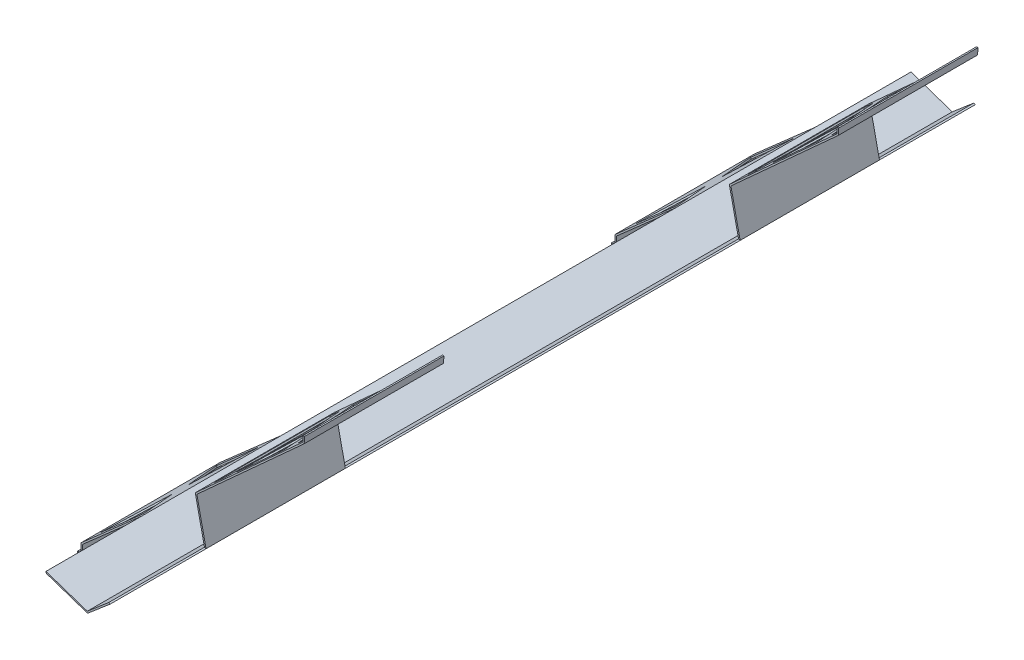
from build123d import *

# Parameters (mm, degrees)
BOSS_EXTRUDE1_DEPTH      = 480
BOSS_EXTRUDE2_DEPTH      = 1360
BOSS_EXTRUDE2_DEPTH_BACK = 810
BOSS_EXTRUDE3_DEPTH      = 480
BOSS_EXTRUDE4_DEPTH      = 330
CUT_EXTRUDE1_DEPTH       = 10
CUT_EXTRUDE1_DEPTH_BACK  = 30


with BuildPart() as part:
    # Sketch1 → Boss-Extrude1 (new body)
    with BuildSketch(Plane.XY):
        Polygon((11, 5), (11, 55), (221.095281021, 240.094497197), (363.24394737, 192.201317564), (437.033049967, 255.054075403), (405.278378965, 401.65435122), (775.552470826, 737.655983503), (777.007438234, 758.382483739), (782.007355561, 758.353577455), (780.57932456, 735.465798021), (410.776173754, 399.891516629), (442.553191716, 253.188072666), (364.330697573, 186.558999959), (222.23449406, 234.434503647), (16, 52.741369955), (16, 0), (0, 0), (0, 25), (5, 25), (5, 5), align=None)
    extrude(amount=BOSS_EXTRUDE1_DEPTH)

    # Sketch3 → Boss-Extrude2 (add, two sides: drawn at the far end of the back side and taken through both)
    with BuildSketch(Plane.XY.offset(480).offset(-BOSS_EXTRUDE2_DEPTH_BACK)):
        Polygon((221.095281021, 240.094497197), (363.24394737, 192.201317564), (437.033049967, 255.054075403), (442.553191716, 253.188072666), (364.330697573, 186.558999959), (222.23449406, 234.434503647), align=None)
    extrude(amount=BOSS_EXTRUDE2_DEPTH + BOSS_EXTRUDE2_DEPTH_BACK)

    # Sketch4 → Boss-Extrude3 (add)
    with BuildSketch(Plane.XY.offset(1840)):
        Polygon((0, 25), (5, 25), (5, 5), (11, 5), (11, 55), (221.095281021, 240.094497197), (363.24394737, 192.201317564), (437.033049967, 255.054075403), (405.278378965, 401.65435122), (775.552470826, 737.655983503), (777.007438234, 758.382483739), (782.007355561, 758.353577455), (780.57932456, 735.465798021), (410.776173754, 399.891516629), (442.553191716, 253.188072666), (364.330697573, 186.558999959), (222.23449406, 234.434503647), (16, 52.741369955), (16, 0), (0, 0), align=None)
    extrude(amount=BOSS_EXTRUDE3_DEPTH)

    # Sketch5 → Boss-Extrude4 (add)
    with BuildSketch(Plane.XY.offset(2320)):
        Polygon((221.095281021, 240.094497197), (363.24394737, 192.201317564), (437.033049967, 255.054075403), (442.553191716, 253.188072666), (364.330697573, 186.558999959), (222.23449406, 234.434503647), align=None)
    extrude(amount=BOSS_EXTRUDE4_DEPTH)

    # Sketch8 → Cut-Extrude1 (cut, two sides: drawn at the far end of the back side and taken through both)
    with BuildSketch(Plane(origin=(-16.864598334, 18.584802074, 0), x_dir=(0.7405481837211553, 0.672003264565953, 0), z_dir=(-0.672003264565953, 0.7405481837211553, 0)).offset(-CUT_EXTRUDE1_DEPTH_BACK)):
        Polygon((710.063615933, -40), (930.018789449, -40), (820.041202691, -230.486767958), align=None)
        Polygon((780.560416253, -240), (647.105417063, -39.497463328), (600.455591152, -39.497463328), (600.455591152, -440.502536672), (647.105417063, -440.502536672), align=None)
        Polygon((859.521989128, -240), (992.976988318, -39.497463328), (1039.62681423, -39.497463328), (1039.62681423, -440.502536672), (992.976988318, -440.502536672), align=None)
        Polygon((820.041202691, -249.513232042), (930.018789449, -440), (710.063615933, -440), align=None)
        Polygon((80.557501261, -440), (279.934557694, -440), (180.246029478, -267.334404198), align=None)
        Polygon((80.557501261, -40), (279.934557694, -40), (180.246029478, -212.665595802), align=None)
        Polygon((710.063615933, -1880), (930.018789449, -1880), (820.041202691, -2070.486767958), align=None)
        Polygon((992.976988318, -1879.497463328), (1039.62681423, -1879.497463328), (1039.62681423, -2280.502536672), (992.976988318, -2280.502536672), (859.521989128, -2080), align=None)
        Polygon((820.041202691, -2089.513232042), (930.018789449, -2280), (710.063615933, -2280), align=None)
        Polygon((780.560416253, -2080), (647.105417063, -1879.497463328), (600.455591152, -1879.497463328), (600.455591152, -2280.502536672), (647.105417063, -2280.502536672), align=None)
        Polygon((80.557501261, -1880), (279.934557694, -1880), (180.246029478, -2052.665595802), align=None)
        Polygon((279.934557694, -2280), (180.246029478, -2107.334404198), (80.557501261, -2280), align=None)
    extrude(amount=CUT_EXTRUDE1_DEPTH + CUT_EXTRUDE1_DEPTH_BACK, mode=Mode.SUBTRACT)


solid = part.part
